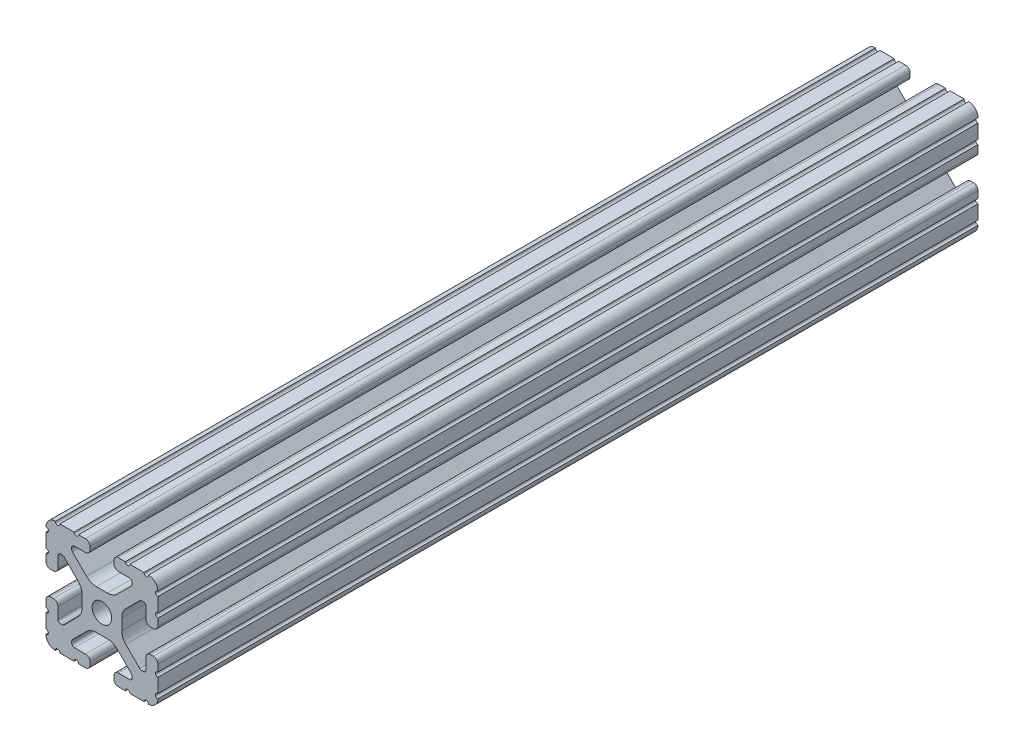
from build123d import *

# Parameters (mm, degrees)
SKETCH1_R      = 3.3274
EXTRUDE1_DEPTH = 279.4


with BuildPart() as part:
    # Sketch1 → Extrude1 (new body)
    with BuildSketch(Plane.XY):
        with BuildLine():
            Line((-10.022898969, 12.91475973), (-5.252158105, 8.144007132))
            ThreePointArc((-5.252158105, 8.144007132), (-3.715177372, 7.117027388), (-1.902183975, 6.7564))
            Line((-1.902183975, 6.7564), (1.902183975, 6.7564))
            ThreePointArc((1.902183975, 6.7564), (3.715177372, 7.117027388), (5.252158105, 8.144007132))
            Line((5.252158105, 8.144007132), (10.022898969, 12.91475973))
            ThreePointArc((10.022898969, 12.91475973), (10.218362387, 13.207291992), (10.287, 13.552357131))
            Line((10.287, 13.552357131), (10.287, 14.0843))
            ThreePointArc((10.287, 14.0843), (10.022898185, 14.721898185), (9.3853, 14.986))
            Line((9.3853, 14.986), (5.617617549, 14.986))
            ThreePointArc((5.617617549, 14.986), (4.519044045, 15.441044045), (4.064, 16.539617549))
            Line((4.064, 16.539617549), (4.064, 17.496382451))
            ThreePointArc((4.064, 17.496382451), (4.519044045, 18.594955955), (5.617617549, 19.05))
            Line((5.617617549, 19.05), (7.974178704, 19.05))
            ThreePointArc((7.974178704, 19.05), (8.736178704, 18.288), (9.498178704, 19.05))
            Line((9.498178704, 19.05), (14.327719207, 19.05))
            ThreePointArc((14.327719207, 19.05), (15.087603123, 18.231251131), (15.847487039, 19.05))
            ThreePointArc((15.847487039, 19.05), (18.120176289, 18.120192083), (19.05, 15.847509295))
            ThreePointArc((19.05, 15.847509295), (18.231250992, 15.08762539), (19.05, 14.327741484))
            Line((19.05, 14.327741484), (19.05, 9.496091471))
            ThreePointArc((19.05, 9.496091471), (18.231250992, 8.736207565), (19.05, 7.97632366))
            Line((19.05, 7.97632366), (19.05, 5.617617549))
            ThreePointArc((19.05, 5.617617549), (18.594955955, 4.519044045), (17.496382451, 4.064))
            Line((17.496382451, 4.064), (16.539617549, 4.064))
            ThreePointArc((16.539617549, 4.064), (15.441044045, 4.519044045), (14.986, 5.617617549))
            Line((14.986, 5.617617549), (14.986, 9.385342516))
            ThreePointArc((14.986, 9.385342516), (14.721898185, 10.022940701), (14.0843, 10.287042516))
            Line((14.0843, 10.287042516), (13.516042086, 10.287042516))
            ThreePointArc((13.516042086, 10.287042516), (13.170975923, 10.218404478), (12.878443117, 10.022939917))
            Line((12.878443117, 10.022939917), (8.14758008, 5.292065243))
            ThreePointArc((8.14758008, 5.292065243), (7.117955879, 3.751120653), (6.7564, 1.933453584))
            Line((6.7564, 1.933453584), (6.7564, -1.933453584))
            ThreePointArc((6.7564, -1.933453584), (7.117955879, -3.751120653), (8.14758008, -5.292065243))
            Line((8.14758008, -5.292065243), (12.878443117, -10.022939917))
            ThreePointArc((12.878443117, -10.022939917), (13.170975923, -10.218404478), (13.516042086, -10.287042516))
            Line((13.516042086, -10.287042516), (14.0843, -10.287042516))
            ThreePointArc((14.0843, -10.287042516), (14.721898185, -10.022940701), (14.986, -9.385342516))
            Line((14.986, -9.385342516), (14.986, -5.617617549))
            ThreePointArc((14.986, -5.617617549), (15.441044045, -4.519044045), (16.539617549, -4.064))
            Line((16.539617549, -4.064), (17.496382451, -4.064))
            ThreePointArc((17.496382451, -4.064), (18.594955955, -4.519044045), (19.05, -5.617617549))
            Line((19.05, -5.617617549), (19.05, -7.976318491))
            ThreePointArc((19.05, -7.976318491), (18.231250992, -8.736202396), (19.05, -9.496086302))
            Line((19.05, -9.496086302), (19.05, -14.32774291))
            ThreePointArc((19.05, -14.32774291), (18.231250992, -15.087626816), (19.05, -15.847510721))
            ThreePointArc((19.05, -15.847510721), (18.120175716, -18.120192644), (15.847486868, -19.05))
            ThreePointArc((15.847486868, -19.05), (15.087602952, -18.231251131), (14.327719036, -19.05))
            Line((14.327719036, -19.05), (9.496062448, -19.05))
            ThreePointArc((9.496062448, -19.05), (8.736178532, -18.231251131), (7.976294616, -19.05))
            Line((7.976294616, -19.05), (5.617617549, -19.05))
            ThreePointArc((5.617617549, -19.05), (4.519044045, -18.594955955), (4.064, -17.496382451))
            Line((4.064, -17.496382451), (4.064, -16.539617549))
            ThreePointArc((4.064, -16.539617549), (4.519044045, -15.441044045), (5.617617549, -14.986))
            Line((5.617617549, -14.986), (9.3853, -14.986))
            ThreePointArc((9.3853, -14.986), (10.022898185, -14.721898185), (10.287, -14.0843))
            Line((10.287, -14.0843), (10.287, -13.552357131))
            ThreePointArc((10.287, -13.552357131), (10.218362387, -13.207291992), (10.022898969, -12.91475973))
            Line((10.022898969, -12.91475973), (5.252158105, -8.144007132))
            ThreePointArc((5.252158105, -8.144007132), (3.715177372, -7.117027388), (1.902183975, -6.7564))
            Line((1.902183975, -6.7564), (-1.902183975, -6.7564))
            ThreePointArc((-1.902183975, -6.7564), (-3.715177372, -7.117027388), (-5.252158105, -8.144007132))
            Line((-5.252158105, -8.144007132), (-10.022898969, -12.91475973))
            ThreePointArc((-10.022898969, -12.91475973), (-10.218362387, -13.207291992), (-10.287, -13.552357131))
            Line((-10.287, -13.552357131), (-10.287, -14.0843))
            ThreePointArc((-10.287, -14.0843), (-10.022898185, -14.721898185), (-9.3853, -14.986))
            Line((-9.3853, -14.986), (-5.617617549, -14.986))
            ThreePointArc((-5.617617549, -14.986), (-4.519044045, -15.441044045), (-4.064, -16.539617549))
            Line((-4.064, -16.539617549), (-4.064, -17.496382451))
            ThreePointArc((-4.064, -17.496382451), (-4.519044045, -18.594955955), (-5.617617549, -19.05))
            Line((-5.617617549, -19.05), (-7.976294616, -19.05))
            ThreePointArc((-7.976294616, -19.05), (-8.736178532, -18.231251131), (-9.496062448, -19.05))
            Line((-9.496062448, -19.05), (-14.327719036, -19.05))
            ThreePointArc((-14.327719036, -19.05), (-15.087602952, -18.231251131), (-15.847486868, -19.05))
            ThreePointArc((-15.847486868, -19.05), (-18.120175716, -18.120192644), (-19.05, -15.847510721))
            ThreePointArc((-19.05, -15.847510721), (-18.231250992, -15.087626816), (-19.05, -14.32774291))
            Line((-19.05, -14.32774291), (-19.05, -9.496086302))
            ThreePointArc((-19.05, -9.496086302), (-18.231250992, -8.736202396), (-19.05, -7.976318491))
            Line((-19.05, -7.976318491), (-19.05, -5.617617549))
            ThreePointArc((-19.05, -5.617617549), (-18.594955955, -4.519044045), (-17.496382451, -4.064))
            Line((-17.496382451, -4.064), (-16.539617549, -4.064))
            ThreePointArc((-16.539617549, -4.064), (-15.441044045, -4.519044045), (-14.986, -5.617617549))
            Line((-14.986, -5.617617549), (-14.986, -9.385342516))
            ThreePointArc((-14.986, -9.385342516), (-14.721898185, -10.022940701), (-14.0843, -10.287042516))
            Line((-14.0843, -10.287042516), (-13.516042086, -10.287042516))
            ThreePointArc((-13.516042086, -10.287042516), (-13.170975923, -10.218404478), (-12.878443117, -10.022939917))
            Line((-12.878443117, -10.022939917), (-8.14758008, -5.292065243))
            ThreePointArc((-8.14758008, -5.292065243), (-7.117955879, -3.751120653), (-6.7564, -1.933453584))
            Line((-6.7564, -1.933453584), (-6.7564, 1.933453584))
            ThreePointArc((-6.7564, 1.933453584), (-7.117955879, 3.751120653), (-8.14758008, 5.292065243))
            Line((-8.14758008, 5.292065243), (-12.878443117, 10.022939917))
            ThreePointArc((-12.878443117, 10.022939917), (-13.170975923, 10.218404478), (-13.516042086, 10.287042516))
            Line((-13.516042086, 10.287042516), (-14.0843, 10.287042516))
            ThreePointArc((-14.0843, 10.287042516), (-14.721898185, 10.022940701), (-14.986, 9.385342516))
            Line((-14.986, 9.385342516), (-14.986, 5.617617549))
            ThreePointArc((-14.986, 5.617617549), (-15.441044045, 4.519044045), (-16.539617549, 4.064))
            Line((-16.539617549, 4.064), (-17.496382451, 4.064))
            ThreePointArc((-17.496382451, 4.064), (-18.594955955, 4.519044045), (-19.05, 5.617617549))
            Line((-19.05, 5.617617549), (-19.05, 7.97632366))
            ThreePointArc((-19.05, 7.97632366), (-18.231250992, 8.736207565), (-19.05, 9.496091471))
            Line((-19.05, 9.496091471), (-19.05, 14.327741484))
            ThreePointArc((-19.05, 14.327741484), (-18.231250992, 15.08762539), (-19.05, 15.847509295))
            ThreePointArc((-19.05, 15.847509295), (-18.120176289, 18.120192083), (-15.847487039, 19.05))
            ThreePointArc((-15.847487039, 19.05), (-15.087603123, 18.231251131), (-14.327719207, 19.05))
            Line((-14.327719207, 19.05), (-9.498178704, 19.05))
            ThreePointArc((-9.498178704, 19.05), (-8.736178704, 18.288), (-7.974178704, 19.05))
            Line((-7.974178704, 19.05), (-5.617617549, 19.05))
            ThreePointArc((-5.617617549, 19.05), (-4.519044045, 18.594955955), (-4.064, 17.496382451))
            Line((-4.064, 17.496382451), (-4.064, 16.539617549))
            ThreePointArc((-4.064, 16.539617549), (-4.519044045, 15.441044045), (-5.617617549, 14.986))
            Line((-5.617617549, 14.986), (-9.3853, 14.986))
            ThreePointArc((-9.3853, 14.986), (-10.022898185, 14.721898185), (-10.287, 14.0843))
            Line((-10.287, 14.0843), (-10.287, 13.552357131))
            ThreePointArc((-10.287, 13.552357131), (-10.218362387, 13.207291992), (-10.022898969, 12.91475973))
        make_face()
        Circle(SKETCH1_R, mode=Mode.SUBTRACT)
    extrude(amount=-EXTRUDE1_DEPTH)


solid = part.part
